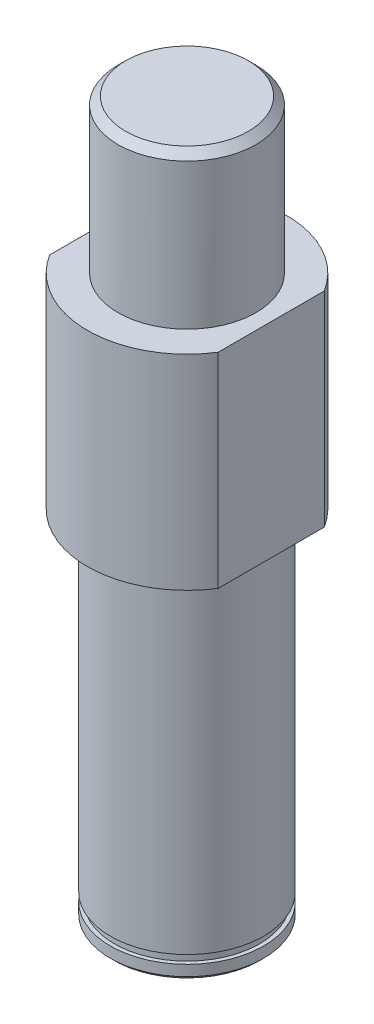
from build123d import *
from build123d.topology import SkipClean

# Parameters (mm, degrees)
CHAMFER_1_SIZE          = 1
CUT_EXTRUDE_1_DEPTH     = 76.279479276
EXTRUDE_2_DEPTH         = 16.7
HOLE_WIZARD_M10_1_D     = 8.5
HOLE_WIZARD_M10_1_DEPTH = 27.5
HOLE_WIZARD_M10_1_TIP   = 2.553657631
CHAMFER_2_SIZE          = 0.5


with BuildPart() as part:
    # 草图1 → 旋转1 (revolve)
    with BuildSketch(Plane.XY, mode=Mode.PRIVATE) as revolve_1_sk:
        Polygon((0, 0), (10, 0), (10, 1.9), (9.5, 1.9), (9.5, 3), (10, 3), (10, 63), (13, 63), (13, 73), (9, 73), (9, 93), (0, 93), align=None)
    revolve(revolve_1_sk.sketch.rotate(Axis((0, 0, 0), (0, 1, 0)), 90), axis=Axis((0, 0, 0), (0, 1, 0)))

    # 倒角1
    chamfer_1_edges = [part.edges().sort_by_distance(p)[0] for p in [
        (0, 93, 9),
    ]]
    chamfer(chamfer_1_edges, length=CHAMFER_1_SIZE)

    # 草图2 → 切除-拉伸1 (cut, through all)
    with BuildSketch(Plane(origin=(0, 73, 0), x_dir=(1, 0, 0), z_dir=(0, 1, 0))):
        with BuildLine():
            Line((-11, -6.92820323), (-11, 6.92820323))
            ThreePointArc((-11, 6.92820323), (-13, 0), (-11, -6.92820323))
        make_face()
        with BuildLine():
            ThreePointArc((13, 0), (12.489995997, 3.605551275), (11, 6.92820323))
            Line((11, 6.92820323), (11, -6.92820323))
            ThreePointArc((11, -6.92820323), (12.489995997, -3.605551275), (13, 0))
        make_face()
    extrude(amount=-CUT_EXTRUDE_1_DEPTH, mode=Mode.SUBTRACT)

    # 草图6 → 凸台-拉伸2 (add)
    with SkipClean():  # the faces are left unmerged after this step: merging them gives an invalid solid
        with BuildSketch(Plane.XZ.offset(-63)):
            with BuildLine():
                Line((11, -6.92820323), (11, 6.92820323))
                ThreePointArc((11, 6.92820323), (0, 13), (-11, 6.92820323))
                Line((-11, 6.92820323), (-11, -6.92820323))
                ThreePointArc((-11, -6.92820323), (0, -13), (11, -6.92820323))
            make_face()
        extrude(amount=EXTRUDE_2_DEPTH)

    # M10 螺纹孔1
    with Locations(Plane(origin=(0, 0, 0), x_dir=(-1, 0, 0), z_dir=(0, -1, 0))):
        with Locations((0, 0)):
            Hole(HOLE_WIZARD_M10_1_D / 2, depth=HOLE_WIZARD_M10_1_DEPTH)
            with Locations((0, 0, -(HOLE_WIZARD_M10_1_DEPTH + HOLE_WIZARD_M10_1_TIP / 2))):  # 118° drill point
                Cone(0, HOLE_WIZARD_M10_1_D / 2, HOLE_WIZARD_M10_1_TIP, mode=Mode.SUBTRACT)

    # 倒角2
    chamfer_2_edges = [part.edges().sort_by_distance(p)[0] for p in [
        (0, 0, 10),
    ]]
    chamfer(chamfer_2_edges, length=CHAMFER_2_SIZE)


solid = part.part
